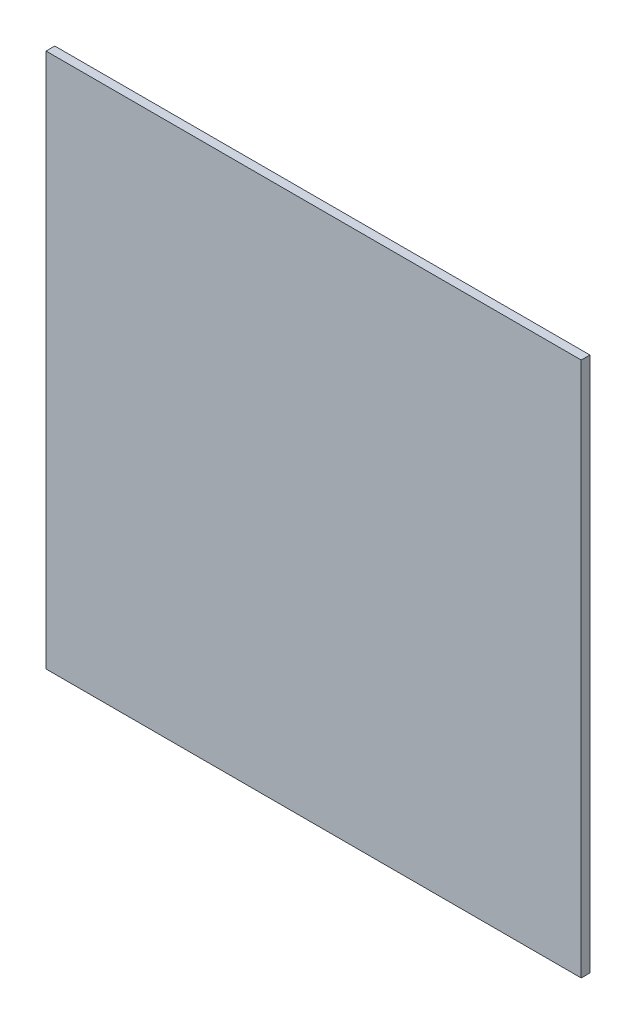
from build123d import *

# Parameters (mm, degrees)
SKETCH1_W           = 184.15
SKETCH1_H           = 184.15
BOSS_EXTRUDE1_DEPTH = 2.999994


with BuildPart() as part:
    # Sketch1 → Boss-Extrude1 (new body)
    with BuildSketch(Plane(origin=(418.388583236, -1281.725585644, 334.273604085), x_dir=(1, 0, 0), z_dir=(0, 0, 1))):
        with Locations((31.225682257, -138.19464627)):
            Rectangle(SKETCH1_W, SKETCH1_H)
    extrude(amount=BOSS_EXTRUDE1_DEPTH)


solid = part.part
